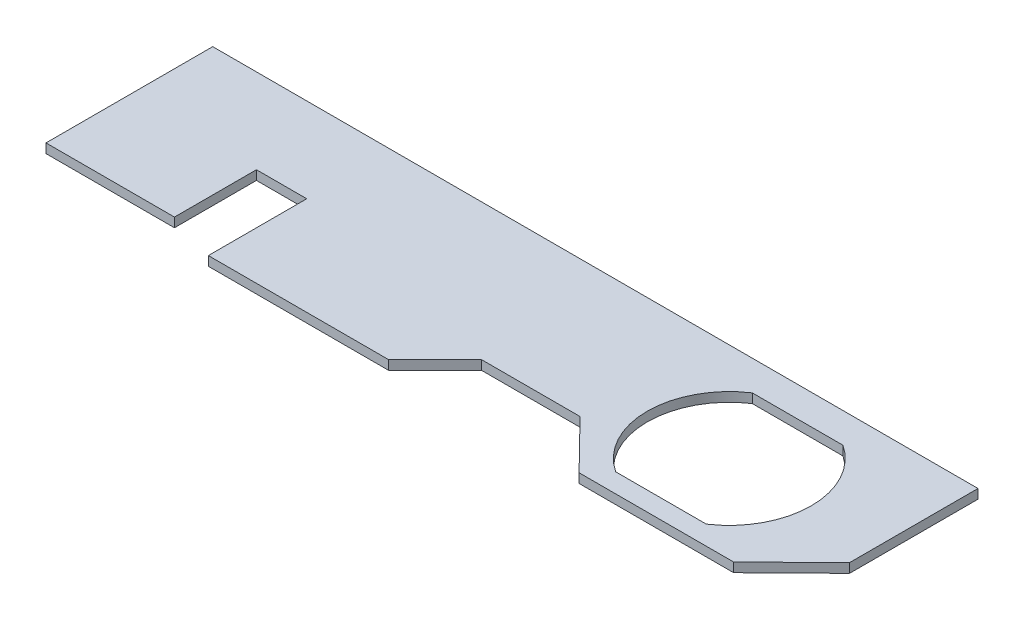
from build123d import *

# Parameters (mm, degrees)
BOSS_EXTRUDE1_DEPTH = 1.7


with BuildPart() as part:
    # Sketch1 → Boss-Extrude1 (new body)
    with BuildSketch(Plane(origin=(0, 0, 0), x_dir=(1, 0, 0), z_dir=(0, 1, 0))):
        Polygon((-8.017928363, -16.55461165), (-8.017928363, -1.55461165), (1.182071637, -1.55461165), (1.182071637, -19.55461165), (34.182071637, -19.55461165), (42.682071637, -11.05461165), (60.682071637, -11.05461165), (69.503836167, -20.05461165), (97.769928994, -20.05461165), (108.482071637, -9.55461165), (108.482071637, 13.94538835), (-31.517928363, 13.94538835), (-31.517928363, -16.55461165), align=None)
        with BuildLine():
            ThreePointArc((72.690509661, 8.44538835), (65.982071637, -4.05461165), (72.690509661, -16.55461165))
            Line((72.690509661, -16.55461165), (89.273633613, -16.55461165))
            ThreePointArc((89.273633613, -16.55461165), (95.982071637, -4.05461165), (89.273633613, 8.44538835))
            Line((89.273633613, 8.44538835), (72.690509661, 8.44538835))
        make_face(mode=Mode.SUBTRACT)
    extrude(amount=BOSS_EXTRUDE1_DEPTH)


solid = part.part
